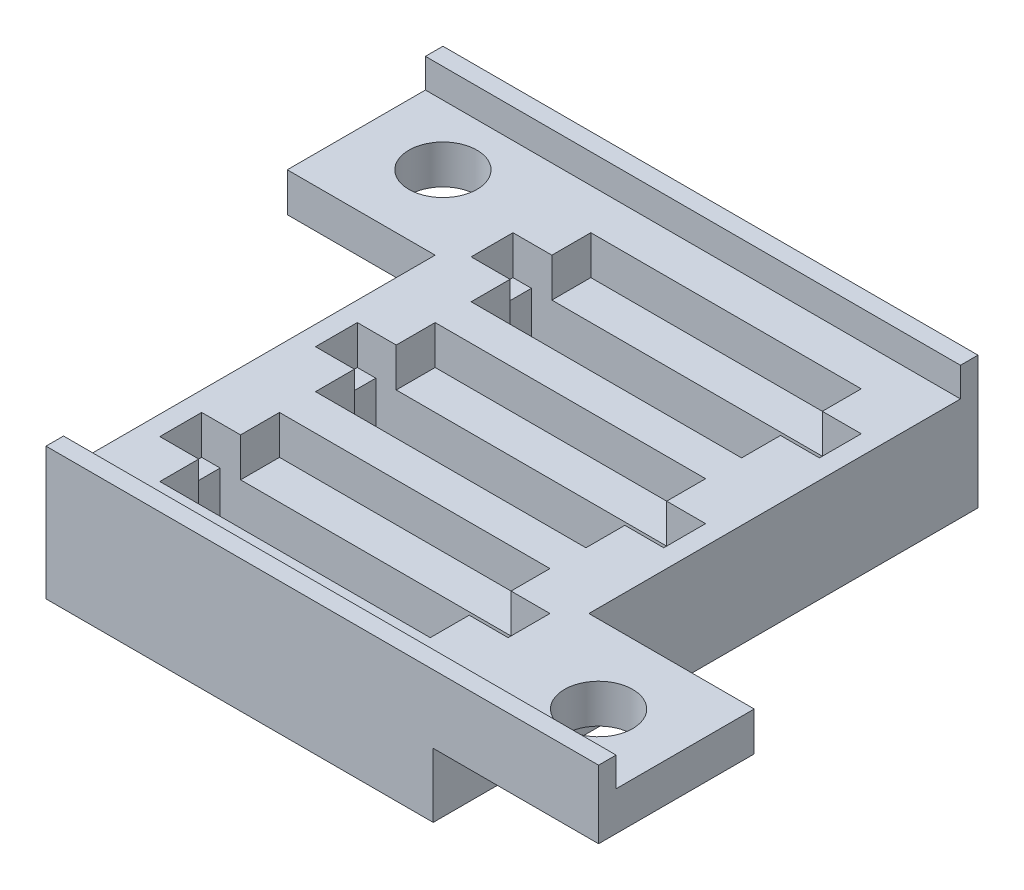
from build123d import *

# Parameters (mm, degrees)
SKETCH1_W                       = 15.9
SKETCH1_H                       = 2.15
SKETCH1_R                       = 1.75
MAIN_BODY_DEPTH                 = 2
SKETCH3_W                       = 17.9
SKETCH3_H                       = 2.15
LIGHT_PIPE_SLOT_CUT_DEPTH       = 2
SKETCH4_W                       = 19.9
SKETCH4_H                       = 28
SKETCH4_W_2                     = 17.9
SKETCH4_H_2                     = 2.15
MAIN_BODY_EXTENSION_DEPTH       = 3.3
SKETCH6_W                       = 27.5
SKETCH6_H                       = 0.9
PCB_EDGE_LIP_ONE_SIDE_DEPTH     = 1.5
SKETCH6_3_W                     = 27.5
SKETCH6_3_H                     = 0.9
SKETCH6_3_W_2                   = 28.4
PCB_EDGE_LIP_ANOTHER_SIDE_DEPTH = 1.5
SKETCH8_W                       = 13.9
SKETCH8_H                       = 6.15
SMD_UNDERSIDE_RECESS_DEPTH      = 2
SKETCH9_W                       = 0.95
SKETCH9_H                       = 2.15
LIGHT_PIPE_STOP_DEPTH           = 3.3


with BuildPart() as part:
    # Sketch1 → Main body (new body)
    with BuildSketch(Plane(origin=(0, 0, 0), x_dir=(1, 0, 0), z_dir=(0, 1, 0))):
        Polygon((-9.6, 15.15), (-2, 15.15), (-2, -4.85), (26.4, -4.85), (26.4, 3.15), (17.9, 3.15), (17.9, 23.15), (-9.6, 23.15), align=None)
        with Locations((7.95, 1.075)):
            Rectangle(SKETCH1_W, SKETCH1_H, mode=Mode.SUBTRACT)
        with Locations((7.95, 9.075)):
            Rectangle(SKETCH1_W, SKETCH1_H, mode=Mode.SUBTRACT)
        with Locations((22.4, -0.85)):
            Circle(SKETCH1_R, mode=Mode.SUBTRACT)
        with Locations((-5.6, 19.15)):
            Circle(SKETCH1_R, mode=Mode.SUBTRACT)
        with Locations((7.95, 17.075)):
            Rectangle(SKETCH1_W, SKETCH1_H, mode=Mode.SUBTRACT)
    extrude(amount=MAIN_BODY_DEPTH)

    # Sketch3 → Light pipe slot cut (cut)
    with BuildSketch(Plane(origin=(0, 2, 0), x_dir=(1, 0, 0), z_dir=(0, 1, 0))):
        with Locations((7.95, 17.075)):
            Rectangle(SKETCH3_W, SKETCH3_H)
        with Locations((7.95, 9.075)):
            Rectangle(SKETCH3_W, SKETCH3_H)
        with Locations((7.95, 1.075)):
            Rectangle(SKETCH3_W, SKETCH3_H)
    extrude(amount=-LIGHT_PIPE_SLOT_CUT_DEPTH, mode=Mode.SUBTRACT)

    # Sketch4 → Main body extension (add)
    with BuildSketch(Plane.XZ):
        with Locations((7.95, -9.15)):
            Rectangle(SKETCH4_W, SKETCH4_H)
        with Locations((7.95, -17.075)):
            Rectangle(SKETCH4_W_2, SKETCH4_H_2, mode=Mode.SUBTRACT)
        with Locations((7.95, -9.075)):
            Rectangle(SKETCH4_W_2, SKETCH4_H_2, mode=Mode.SUBTRACT)
        with Locations((7.95, -1.075)):
            Rectangle(SKETCH4_W_2, SKETCH4_H_2, mode=Mode.SUBTRACT)
    extrude(amount=MAIN_BODY_EXTENSION_DEPTH)

    # Sketch6 → PCB edge lip one side (add)
    with BuildSketch(Plane(origin=(0, 2, 0), x_dir=(1, 0, 0), z_dir=(0, 1, 0))):
        with Locations((4.15, 22.7)):
            Rectangle(SKETCH6_W, SKETCH6_H)
    extrude(amount=PCB_EDGE_LIP_ONE_SIDE_DEPTH)

    # Sketch6<3> → PCB edge lip another side (add)
    with BuildSketch(Plane(origin=(0, 2, 0), x_dir=(1, 0, 0), z_dir=(0, 1, 0))):
        with Locations((4.15, 22.7)):
            Rectangle(SKETCH6_3_W, SKETCH6_3_H)
        with Locations((12.2, -4.4)):
            Rectangle(SKETCH6_3_W_2, SKETCH6_3_H)
    extrude(amount=PCB_EDGE_LIP_ANOTHER_SIDE_DEPTH)

    # Sketch8 → SMD underside recess (cut)
    with BuildSketch(Plane(origin=(0, 2, 0), x_dir=(1, 0, 0), z_dir=(0, 1, 0))):
        with Locations((7.95, 17.075)):
            Rectangle(SKETCH8_W, SKETCH8_H)
        with Locations((7.95, 1.075)):
            Rectangle(SKETCH8_W, SKETCH8_H)
        with Locations((7.95, 9.075)):
            Rectangle(SKETCH8_W, SKETCH8_H)
    extrude(amount=-SMD_UNDERSIDE_RECESS_DEPTH, mode=Mode.SUBTRACT)

    # Sketch9 → Light pipe stop (add)
    with BuildSketch(Plane.XZ.offset(3.3)):
        with Locations((-0.525, -1.075)):
            Rectangle(SKETCH9_W, SKETCH9_H)
        with Locations((-0.525, -17.075)):
            Rectangle(SKETCH9_W, SKETCH9_H)
        with Locations((16.425, -1.075)):
            Rectangle(SKETCH9_W, SKETCH9_H)
        with Locations((16.425, -17.075)):
            Rectangle(SKETCH9_W, SKETCH9_H)
        with Locations((-0.525, -9.075)):
            Rectangle(SKETCH9_W, SKETCH9_H)
        with Locations((16.425, -9.075)):
            Rectangle(SKETCH9_W, SKETCH9_H)
    extrude(amount=-LIGHT_PIPE_STOP_DEPTH)


solid = part.part
